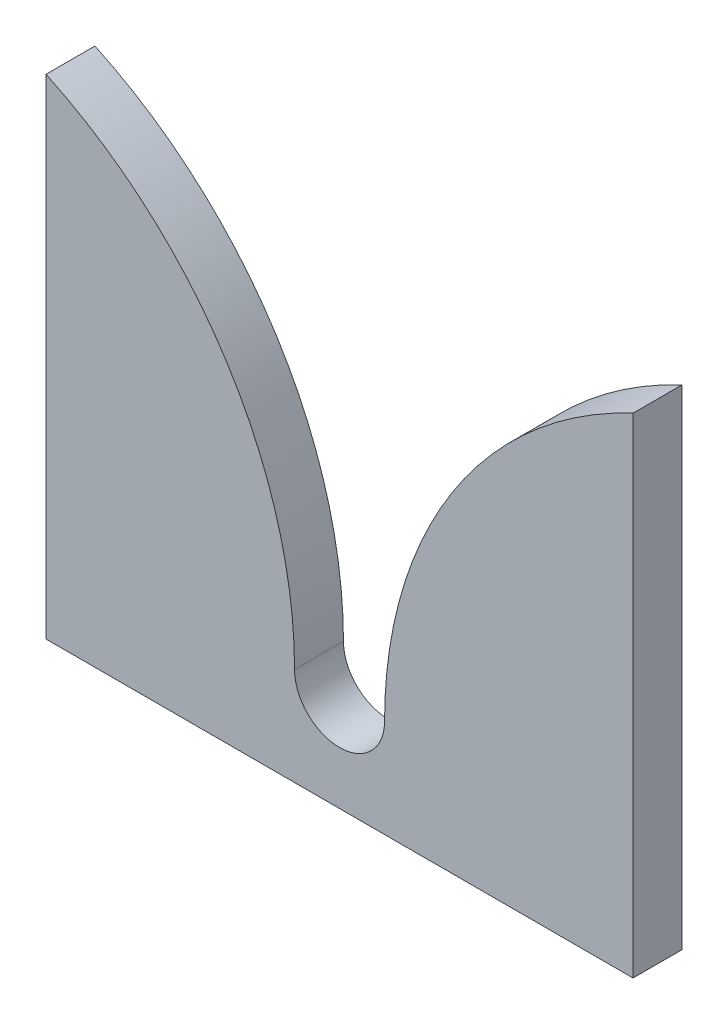
from build123d import *

# Parameters (mm, degrees)
BOSS_EXTRUDE2_DEPTH = 3.175


with BuildPart() as part:
    # Sketch1 → Boss-Extrude2 (new, symmetric)
    with BuildSketch(Plane.XY):
        with BuildLine():
            Line((76.2, 0), (76.2, 6.35))
            Line((76.2, 6.35), (76.2, 63.5))
            ThreePointArc((76.2, 63.5), (52.687880643, 42.788280792), (43.942, 12.7))
            ThreePointArc((43.942, 12.7), (38.1, 6.858), (32.258, 12.7))
            ThreePointArc((32.258, 12.7), (23.512119357, 42.788280792), (0, 63.5))
            Line((0, 63.5), (0, 6.35))
            Line((0, 6.35), (0, 0))
            Line((0, 0), (76.2, 0))
        make_face()
    extrude(amount=BOSS_EXTRUDE2_DEPTH, both=True)


solid = part.part
